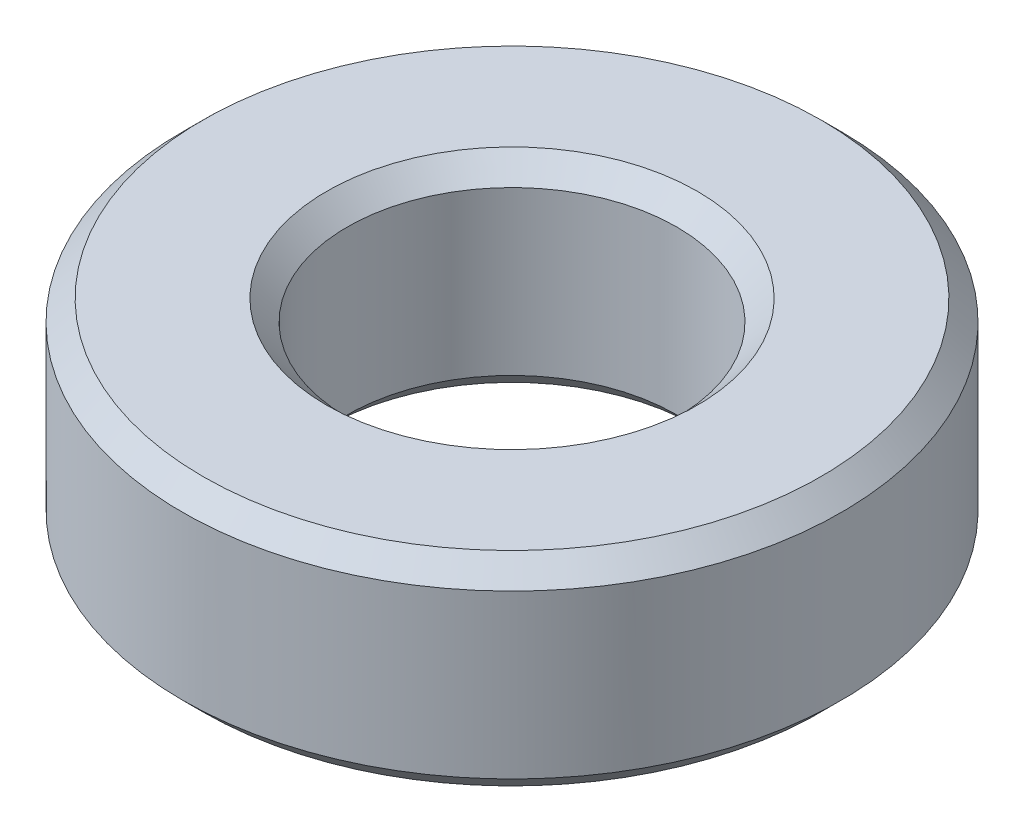
from build123d import *

# Parameters (mm, degrees)
SKETCH1_R           = 8
SKETCH1_R_2         = 4
BOSS_EXTRUDE1_DEPTH = 4.95
CHAMFER1_SIZE       = 0.5


with BuildPart() as part:
    # Sketch1 → Boss-Extrude1 (new body)
    with BuildSketch(Plane(origin=(0, 0, 0), x_dir=(1, 0, 0), z_dir=(0, 1, 0))):
        with Locations(Location((0, 0, 0), (0, 0, 90))):
            Circle(SKETCH1_R)
        with Locations(Location((0, 0, 0), (0, 0, 90))):
            Circle(SKETCH1_R_2, mode=Mode.SUBTRACT)
    extrude(amount=BOSS_EXTRUDE1_DEPTH)

    # Chamfer1
    chamfer1_edges = [part.edges().sort_by_distance(p)[0] for p in [
        (0, 0, 8),
        (0, 4.95, 8),
        (0, 0, 4),
        (0, 4.95, 4),
    ]]
    chamfer(chamfer1_edges, length=CHAMFER1_SIZE)


solid = part.part
